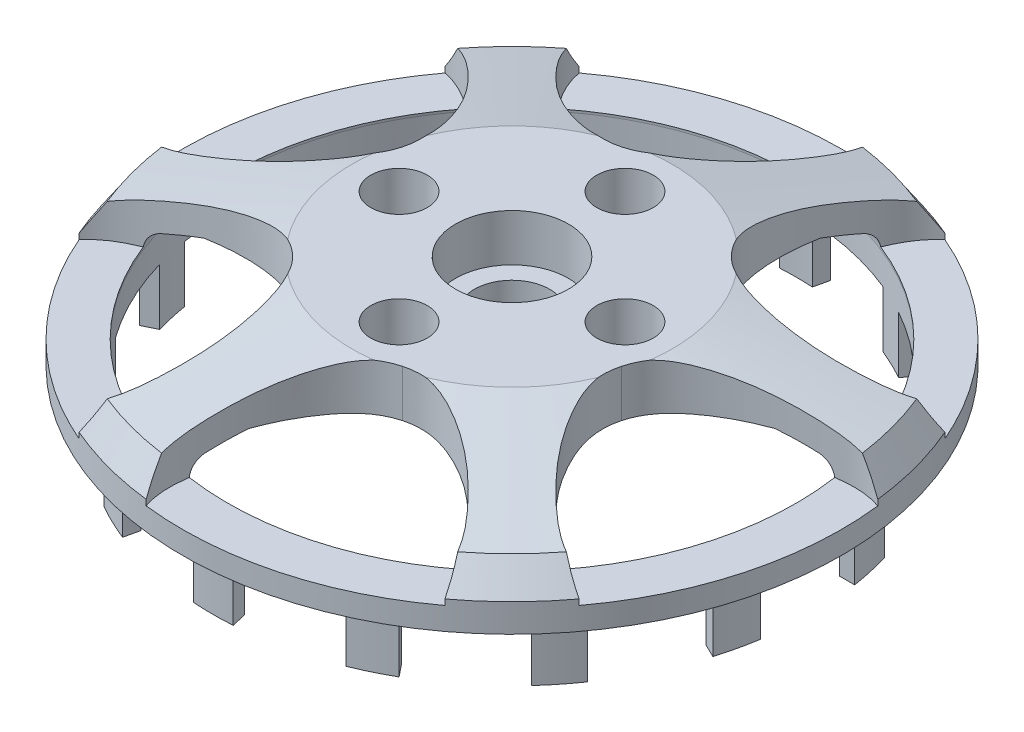
from build123d import *

# Parameters (mm, degrees)
SKETCH_3_R               = 2
SKETCH_3_R_2             = 1.5
CUT_EXTRUDE_1_DEPTH      = 27.167728216
SKETCH_4_W               = 7.796090955
SKETCH_4_H               = 5
SKETCH_4_W_2             = 6.982136138
CUT_EXTRUDE_2_DEPTH      = 3
PATTERN_CIRCULAR_1_COUNT = 14
FILLET_1_R               = 1
CUT_EXTRUDE_5_DEPTH      = 3.8
PATTERN_CIRCULAR_2_COUNT = 6
SKETCH_6_R               = 3
CUT_EXTRUDE_6_DEPTH      = 2.5


with BuildPart() as part:
    # Эскиз2 → Повернуть1 (revolve)
    with BuildSketch(Plane.XY, mode=Mode.PRIVATE) as revolve_1_sk:
        Polygon((0, 0), (8.5, 0), (16.5, -2), (17.5, -3.5), (17.5, -5), (15.9, -5), (15.9, -8.5), (15.1, -8.5), (15.1, -3.15), (12.5, -2.5), (5.5, -2.5), (5.5, -4.5), (3, -5.5), (0, -5.5), align=None)
    revolve(revolve_1_sk.sketch.rotate(Axis((0, 0, 0), (0, 1, 0)), 90), axis=Axis((0, 0, 0), (0, 1, 0)))

    # Эскиз3 → Вырез-Вытянуть1 (cut, through all)
    with BuildSketch(Plane(origin=(0, 0, 0), x_dir=(1, 0, 0), z_dir=(0, 1, 0))):
        with Locations(Location((0, 0, 0), (0, 0, 270))):
            Circle(SKETCH_3_R)
        with Locations(Location((0, 6, 0), (0, 0, 270))):
            Circle(SKETCH_3_R_2)
        with Locations(Location((6, 0, 0), (0, 0, 270))):
            Circle(SKETCH_3_R_2)
        with Locations(Location((0, -6, 0), (0, 0, 270))):
            Circle(SKETCH_3_R_2)
        with Locations(Location((-6, 0, 0), (0, 0, 270))):
            Circle(SKETCH_3_R_2)
    extrude(amount=-CUT_EXTRUDE_1_DEPTH, mode=Mode.SUBTRACT)

    # Эскиз4 → Вырез-Вытянуть2 (cut)
    with BuildSketch(Plane.XZ.offset(8.5)):
        with Locations((-16.145494191, 0)):
            Rectangle(SKETCH_4_W, SKETCH_4_H)
        with Locations((16.5524716, 0)):
            Rectangle(SKETCH_4_W_2, SKETCH_4_H)
    cut_extrude_2 = extrude(amount=-CUT_EXTRUDE_2_DEPTH, mode=Mode.SUBTRACT)

    # Круговой массив1: Вырез-Вытянуть2 ×14 about axis
    pattern_circular_1_axis = Axis((0, 0, 0), (0, 1, 0))
    for i in range(1, PATTERN_CIRCULAR_1_COUNT):
        add(cut_extrude_2.rotate(pattern_circular_1_axis, i * 360 / PATTERN_CIRCULAR_1_COUNT), mode=Mode.SUBTRACT)

    # Скругление1
    fillet_1_edges = [part.edges().sort_by_distance(p)[0] for p in [
        (0, -3.15, 15.1),
    ]]
    fillet(fillet_1_edges, radius=FILLET_1_R)

    # Эскиз5 → Вырез-Вытянуть5 (cut)
    with BuildSketch(Plane(origin=(0, 0, 0), x_dir=(1, 0, 0), z_dir=(0, 1, 0))):
        with BuildLine():
            Line((6.915904313, 16.075455438), (13.069808636, 17.30743274))
            Line((13.069808636, 17.30743274), (17.734251922, 13.38879948))
            Line((17.734251922, 13.38879948), (16.075455438, 6.915904313))
            add(Edge.make_bspline(
                [(16.075455438, 6.915904313), (15.359112025, 6.085873274), (12.888621423, 4.963428926), (9.142645394, 4.362507933), (6.580426703, 5.067883555), (5.822871983, 5.822871983)],
                knots=[0, 0, 0, 0, 0.287311606, 0.73699709, 1, 1, 1, 1], degree=3))
            add(Edge.make_bspline(
                [(6.915904313, 16.075455438), (6.085873274, 15.359112025), (4.963428926, 12.888621423), (4.362507933, 9.142645394), (5.067883555, 6.580426703), (5.822871983, 5.822871983)],
                knots=[0, 0, 0, 0, 0.287311606, 0.73699709, 1, 1, 1, 1], degree=3))
        make_face()
    cut_extrude_5 = extrude(amount=-CUT_EXTRUDE_5_DEPTH, mode=Mode.SUBTRACT)

    # Круговой массив2: Вырез-Вытянуть5 ×6 about axis
    pattern_circular_2_axis = Axis((0, -8.5, 0), (0, 1, 0))
    for i in range(1, PATTERN_CIRCULAR_2_COUNT):
        add(cut_extrude_5.rotate(pattern_circular_2_axis, i * 360 / PATTERN_CIRCULAR_2_COUNT), mode=Mode.SUBTRACT)

    # Эскиз6 → Вырез-Вытянуть6 (cut)
    with BuildSketch(Plane(origin=(0, 0, 0), x_dir=(1, 0, 0), z_dir=(0, 1, 0))):
        with Locations(Location((0, 0, 0), (0, 0, 270))):
            Circle(SKETCH_6_R)
    extrude(amount=-CUT_EXTRUDE_6_DEPTH, mode=Mode.SUBTRACT)


solid = part.part
